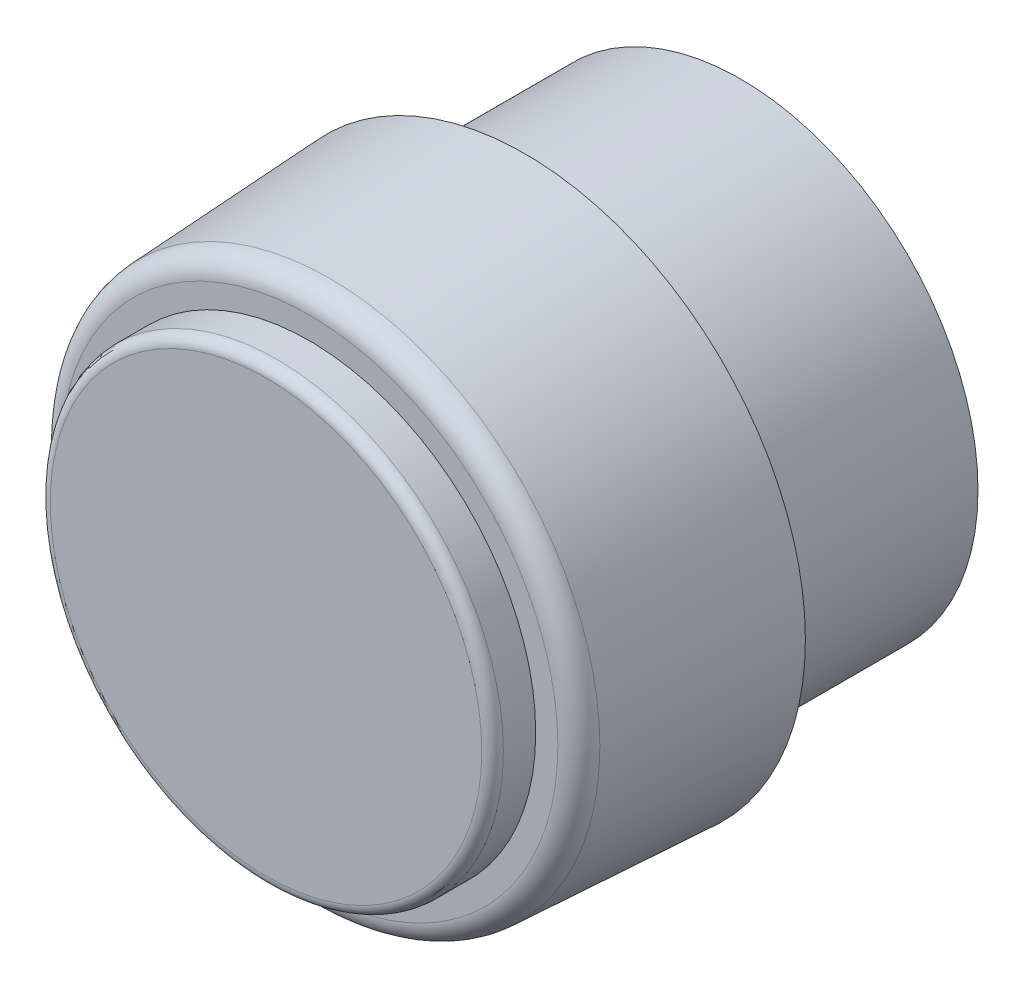
from build123d import *

# Parameters (mm, degrees)
SKETCH_1_R      = 11
EXTRUDE_1_DEPTH = 10
SKETCH_2_R      = 13
EXTRUDE_2_DEPTH = 10
EXTRUDE_2_TAPER = 3
FILLET_1_R      = 1
SKETCH_3_R      = 10.5
EXTRUDE_3_DEPTH = 2
FILLET_2_R      = 0.5


with BuildPart() as part:
    # 草图1 → 凸台-拉伸1 (new body)
    with BuildSketch(Plane.XY):
        Circle(SKETCH_1_R)
    extrude(amount=EXTRUDE_1_DEPTH)

    # 草图2 → 凸台-拉伸2 (add)
    with BuildSketch(Plane.XY.offset(10)):
        Circle(SKETCH_2_R)
    extrude(amount=EXTRUDE_2_DEPTH, taper=EXTRUDE_2_TAPER)

    # 圆角1
    fillet_1_edges = [part.edges().sort_by_distance(p)[0] for p in [
        (-12.475922207, 0, 20),
    ]]
    fillet(fillet_1_edges, radius=FILLET_1_R)

    # 草图3 → 凸台-拉伸3 (add)
    with BuildSketch(Plane.XY.offset(20)):
        Circle(SKETCH_3_R)
    extrude(amount=EXTRUDE_3_DEPTH)

    # 圆角2
    fillet_2_edges = [part.edges().sort_by_distance(p)[0] for p in [
        (-10.5, 0, 22),
    ]]
    fillet(fillet_2_edges, radius=FILLET_2_R)


solid = part.part
